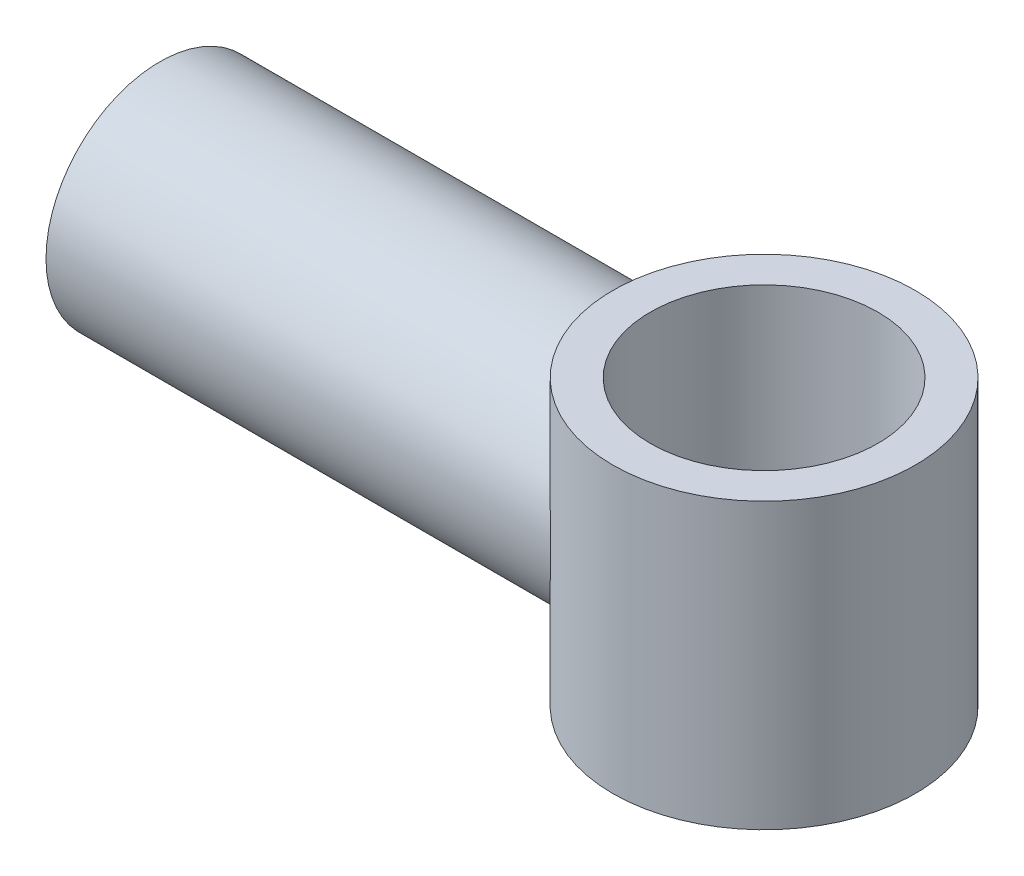
from build123d import *

# Parameters (mm, degrees)
EXTRUDE_1_DEPTH      = 50
EXTRUDE_1_DEPTH_BACK = 50
SKETCH_1_R           = 53.17170267
SKETCH_1_R_2         = 40
EXTRUDE_2_REACH      = 277.419
EXTRUDE_2_END_RADIUS = 53.17170267
SKETCH_2_R           = 40


with BuildPart() as part:
    # 草图1 → 凸台-拉伸1 (new, two sides: drawn at the far end of the back side and taken through both)
    with BuildSketch(Plane(origin=(0, 0, 0), x_dir=(1, 0, 0), z_dir=(0, 1, 0)).offset(-EXTRUDE_1_DEPTH_BACK)):
        with Locations(Location((0, 0, 0), (0, 0, 90))):
            Circle(SKETCH_1_R)
        with Locations(Location((0, 0, 0), (0, 0, 90))):
            Circle(SKETCH_1_R_2, mode=Mode.SUBTRACT)
    extrude(amount=EXTRUDE_1_DEPTH + EXTRUDE_1_DEPTH_BACK)

    # 凸台-拉伸2: up to this cylinder (the profile starts outside it)
    extrude_2_end = Plane(origin=(0, 0, 0), z_dir=(0, -1, 0)) * Cylinder(EXTRUDE_2_END_RADIUS, 662.18140534, mode=Mode.PRIVATE)
    # 草图2 → 凸台-拉伸2 (add, up to the surface)
    with BuildSketch(Plane(origin=(-212.4, 0, 0), x_dir=(0, 0, -1), z_dir=(1, 0, 0)), mode=Mode.PRIVATE) as extrude_2_sk1:
        with Locations(Location((0, 0, 0), (0, 0, 180))):
            Circle(SKETCH_2_R)
    extrude_2_tool1 = extrude(extrude_2_sk1.sketch, amount=EXTRUDE_2_REACH, mode=Mode.PRIVATE) - extrude_2_end
    add(extrude_2_tool1.solids().sort_by_distance((-212.4, 0, 0))[0])


solid = part.part
